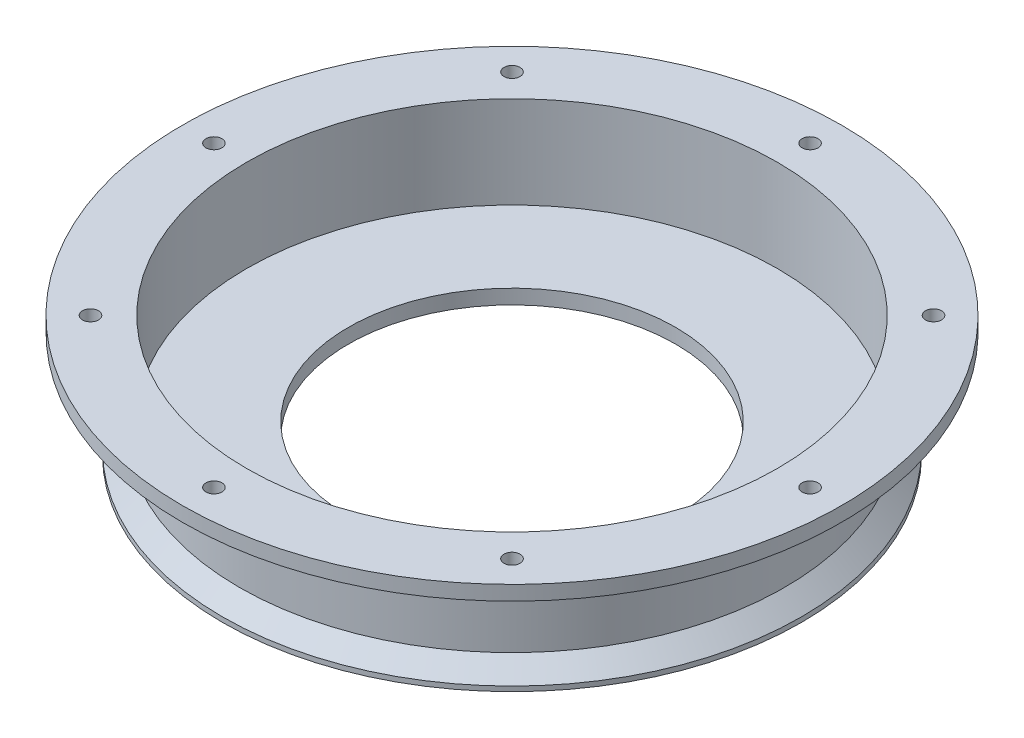
from build123d import *

# Parameters (mm, degrees)
SKETCH_2_R               = 3.3
BASE_PLATE_M6_DEPTH      = 198.301799282
PATTERN_CIRCULAR_1_COUNT = 8


with BuildPart() as part:
    # ｽｹｯﾁ1 → 回転1 (revolve)
    with BuildSketch(Plane.XY, mode=Mode.PRIVATE) as revolve_1_sk:
        Polygon((-109.5, 26.845447074), (-136, 26.845447074), (-136, 20.845447074), (-112.5, 20.845447074), (-112.5, -14.154552926), (-119.5, -21.154552926), (-119.5, -23.154552926), (-110, -23.154552926), (-104, -17.154552926), (-67.5, -17.154552926), (-67.5, -11.154552926), (-109.5, -11.154552926), align=None)
    revolve(revolve_1_sk.sketch.rotate(Axis((0, 100.817249739, 0), (0, -1, 0)), 270), axis=Axis((0, 100.817249739, 0), (0, -1, 0)))

    # ｽｹｯﾁ2 → Base_Plateへの固定用穴(M6の六角ボルトを使用) (cut, through all)
    with BuildSketch(Plane.XZ.offset(-20.845447074)):
        with Locations(Location((123, 0, 0), (0, 0, 270))):
            Circle(SKETCH_2_R)
    base_plate_m6 = extrude(amount=-BASE_PLATE_M6_DEPTH, mode=Mode.SUBTRACT)

    # 円形ﾊﾟﾀｰﾝ1: Base_Plateへの固定用穴(M6の六角ボルトを使用) ×8 about axis
    pattern_circular_1_axis = Axis((0, 0, 0), (0, 1, 0))
    for i in range(1, PATTERN_CIRCULAR_1_COUNT):
        add(base_plate_m6.rotate(pattern_circular_1_axis, i * 360 / PATTERN_CIRCULAR_1_COUNT), mode=Mode.SUBTRACT)


solid = part.part
